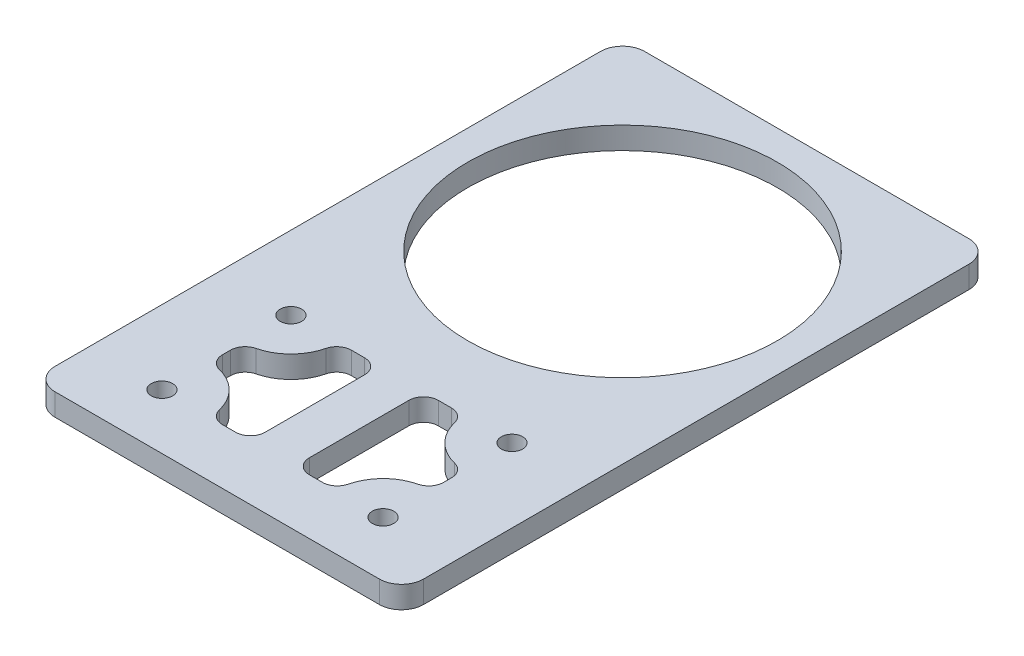
from build123d import *

# Parameters (mm, degrees)
SKETCH_1_W          = 50
SKETCH_1_H          = 50
SKETCH_1_R          = 21
EXTRUDE_1_DEPTH     = 3
SKETCH_2_W          = 50
SKETCH_2_H          = 30
SKETCH_2_R          = 1.45
EXTRUDE_2_DEPTH     = 3
FILLET_1_R          = 3
SKETCH_3_R          = 1.45
CUT_EXTRUDE_1_DEPTH = 61.489668539
CUT_EXTRUDE_7_DEPTH = 61.489668539
SKETCH_13_W         = 6
SKETCH_13_H         = 17.5
EXTRUDE_3_DEPTH     = 3
FILLET_2_R          = 2


with BuildPart() as part:
    # 草图1 → 凸台-拉伸1 (new body)
    with BuildSketch(Plane(origin=(0, 0, 0), x_dir=(1, 0, 0), z_dir=(0, 1, 0))):
        Rectangle(SKETCH_1_W, SKETCH_1_H)
        with Locations(Location((0, 0, 0), (0, 0, 270))):
            Circle(SKETCH_1_R, mode=Mode.SUBTRACT)
    extrude(amount=EXTRUDE_1_DEPTH)

    # 草图2 → 凸台-拉伸2 (add)
    with BuildSketch(Plane(origin=(0, 3, 0), x_dir=(1, 0, 0), z_dir=(0, 1, 0))):
        with Locations((0, -40)):
            Rectangle(SKETCH_2_W, SKETCH_2_H)
        with Locations(Location((-15, -47.5, 0), (0, 0, 270))):
            Circle(SKETCH_2_R, mode=Mode.SUBTRACT)
        with Locations(Location((15, -47.5, 0), (0, 0, 270))):
            Circle(SKETCH_2_R, mode=Mode.SUBTRACT)
    extrude(amount=-EXTRUDE_2_DEPTH)

    # 圆角1
    fillet_1_edges = [part.edges().sort_by_distance(p)[0] for p in [
        (25, 1.5, 55),
        (-25, 1.5, 55),
        (-25, 1.5, -25),
        (25, 1.5, -25),
    ]]
    fillet(fillet_1_edges, radius=FILLET_1_R)

    # 草图3 → 切除-拉伸1 (cut, through all)
    with BuildSketch(Plane(origin=(0, 3, 0), x_dir=(1, 0, 0), z_dir=(0, 1, 0))):
        with Locations(Location((-15, -30, 0), (0, 0, 270))):
            Circle(SKETCH_3_R)
        with Locations(Location((15, -30, 0), (0, 0, 270))):
            Circle(SKETCH_3_R)
    extrude(amount=-CUT_EXTRUDE_1_DEPTH, mode=Mode.SUBTRACT)

    # 草图12 → 切除-拉伸7 (cut, through all)
    with BuildSketch(Plane(origin=(0, 3, 0), x_dir=(1, 0, 0), z_dir=(0, 1, 0))):
        with BuildLine():
            ThreePointArc((-8.55, -30), (-10.439161261, -34.560838739), (-15, -36.45))
            Line((-15, -36.45), (-15, -41.05))
            ThreePointArc((-15, -41.05), (-10.439161261, -42.939161261), (-8.55, -47.5))
            Line((-8.55, -47.5), (8.55, -47.5))
            ThreePointArc((8.55, -47.5), (10.439161261, -42.939161261), (15, -41.05))
            Line((15, -41.05), (15, -36.45))
            ThreePointArc((15, -36.45), (10.439161261, -34.560838739), (8.55, -30))
            Line((8.55, -30), (-8.55, -30))
        make_face()
    extrude(amount=-CUT_EXTRUDE_7_DEPTH, mode=Mode.SUBTRACT)

    # 草图13 → 凸台-拉伸3 (add)
    with BuildSketch(Plane(origin=(0, 3, 0), x_dir=(1, 0, 0), z_dir=(0, 1, 0))):
        with Locations((0, -38.75)):
            Rectangle(SKETCH_13_W, SKETCH_13_H)
    extrude(amount=-EXTRUDE_3_DEPTH)

    # 圆角2
    fillet_2_edges = [part.edges().sort_by_distance(p)[0] for p in [
        (-3, 1.5, 30),
        (3, 1.5, 30),
        (3, 1.5, 47.5),
        (-3, 1.5, 47.5),
        (15, 1.5, 41.05),
        (8.55, 1.5, 47.5),
        (-8.55, 1.5, 47.5),
        (-15, 1.5, 41.05),
        (-15, 1.5, 36.45),
        (-8.55, 1.5, 30),
        (8.55, 1.5, 30),
        (15, 1.5, 36.45),
    ]]
    fillet(fillet_2_edges, radius=FILLET_2_R)


solid = part.part
